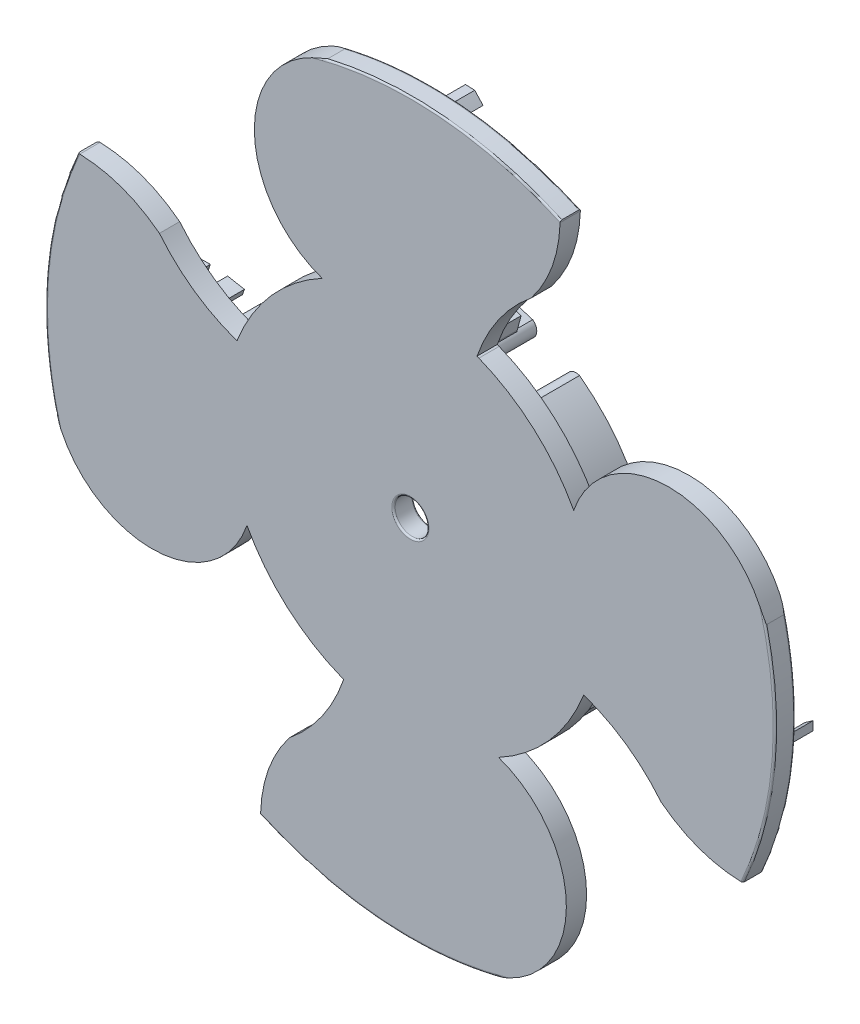
from build123d import *

# Parameters (mm, degrees)
ESQUISSE1_R             = 54
BOSS_EXTRU_1_DEPTH      = 3
ESQUISSE2_R             = 2.5
ENL_V_MAT_EXTRU_1_DEPTH = 77.426435217
CONG_1_R                = 0.25
ENL_V_MAT_EXTRU_3_DEPTH = 6
BOSS_EXTRU_2_DEPTH      = 6
BOSS_EXTRU_3_DEPTH      = 3
ESQUISSE7_R             = 32.5
ESQUISSE7_R_2           = 30
ENL_V_MAT_EXTRU_4_DEPTH = 3
ESQUISSE8_R             = 37.5
ESQUISSE8_R_2           = 35
ENL_V_MAT_EXTRU_5_DEPTH = 3
ESQUISSE9_R             = 42.5
ESQUISSE9_R_2           = 40
ENL_V_MAT_EXTRU_6_DEPTH = 3
ESQUISSE10_R            = 47.5
ESQUISSE10_R_2          = 45
ENL_V_MAT_EXTRU_7_DEPTH = 3
ESQUISSE11_R            = 52.5
ESQUISSE11_R_2          = 50
ENL_V_MAT_EXTRU_8_DEPTH = 3
CONG_2_R                = 0.25
CONG_4_R                = 0.25


with BuildPart() as part:
    # Esquisse1 → Boss.-Extru.1 (new body)
    with BuildSketch(Plane.XY):
        Circle(ESQUISSE1_R)
    extrude(amount=BOSS_EXTRU_1_DEPTH)

    # Esquisse2 → Enlèv. mat.-Extru.1 (cut, through all)
    with BuildSketch(Plane.XY.offset(3)):
        Circle(ESQUISSE2_R)
    extrude(amount=-ENL_V_MAT_EXTRU_1_DEPTH, mode=Mode.SUBTRACT)

    # Congé1
    cong_1_edges = [part.edges().sort_by_distance(p)[0] for p in [
        (-54, 0, 0),
        (-54, 0, 3),
    ]]
    fillet(cong_1_edges, radius=CONG_1_R)

    # Esquisse4 → Enlèv. mat.-Extru.3 (cut)
    with BuildSketch(Plane.XY.offset(3)):
        with BuildLine():
            Line((10.147494885, 25.559310389), (9.869093006, 25.668093097))
            ThreePointArc((9.869093006, 25.668093097), (13.084415188, 31.983211129), (17.916194387, 37.16712107))
            add(Edge.make_bspline(
                [(17.916194387, 37.16712107), (21.972653712, 42.426454658), (22.178832884, 48.960819763)],
                knots=[0, 0, 0, 1, 1, 1], degree=2))
            Line((22.178832884, 48.960819763), (22.293738471, 50.024043225))
            Line((22.293738471, 50.024043225), (35.112139276, 43.739905038))
            Line((35.112139276, 43.739905038), (38.990932512, 44.188049256))
            Line((38.990932512, 44.188049256), (53.026120216, 33.383027581))
            Line((53.026120216, 33.383027581), (55.655170053, 10.62798506))
            Line((55.655170053, 10.62798506), (53.026120216, 10.209337629))
            ThreePointArc((53.026120216, 10.209337629), (39.741245532, 23.034120654), (24.197434096, 13.066529116))
            ThreePointArc((24.197434096, 13.066529116), (18.273229946, 20.550889697), (10.147494885, 25.559310389))
        make_face()
        with BuildLine():
            Line((10.209337629, -53.026120216), (10.62798506, -55.655170053))
            Line((10.62798506, -55.655170053), (33.383027581, -53.026120216))
            Line((33.383027581, -53.026120216), (44.188049256, -38.990932512))
            Line((44.188049256, -38.990932512), (43.739905038, -35.112139276))
            Line((43.739905038, -35.112139276), (50.024043225, -22.293738471))
            Line((50.024043225, -22.293738471), (48.960819763, -22.178832884))
            add(Edge.make_bspline(
                [(37.16712107, -17.916194387), (42.426454658, -21.972653712), (48.960819763, -22.178832884)],
                knots=[0, 0, 0, 1, 1, 1], degree=2))
            ThreePointArc((37.16712107, -17.916194387), (31.983211129, -13.084415188), (25.668093097, -9.869093006))
            Line((25.668093097, -9.869093006), (25.559310389, -10.147494885))
            ThreePointArc((25.559310389, -10.147494885), (20.550889697, -18.273229946), (13.066529116, -24.197434096))
            ThreePointArc((13.066529116, -24.197434096), (23.034120654, -39.741245532), (10.209337629, -53.026120216))
        make_face()
        with BuildLine():
            Line((-53.026120216, -10.209337629), (-55.655170053, -10.62798506))
            Line((-55.655170053, -10.62798506), (-53.026120216, -33.383027581))
            Line((-53.026120216, -33.383027581), (-38.990932512, -44.188049256))
            Line((-38.990932512, -44.188049256), (-35.112139276, -43.739905038))
            Line((-35.112139276, -43.739905038), (-22.293738471, -50.024043225))
            Line((-22.293738471, -50.024043225), (-22.178832884, -48.960819763))
            add(Edge.make_bspline(
                [(-17.916194387, -37.16712107), (-21.972653712, -42.426454658), (-22.178832884, -48.960819763)],
                knots=[0, 0, 0, 1, 1, 1], degree=2))
            ThreePointArc((-17.916194387, -37.16712107), (-13.084415188, -31.983211129), (-9.869093006, -25.668093097))
            Line((-9.869093006, -25.668093097), (-10.147494885, -25.559310389))
            ThreePointArc((-10.147494885, -25.559310389), (-18.273229946, -20.550889697), (-24.197434096, -13.066529116))
            ThreePointArc((-24.197434096, -13.066529116), (-39.741245532, -23.034120654), (-53.026120216, -10.209337629))
        make_face()
        with BuildLine():
            Line((-10.209337629, 53.026120216), (-10.62798506, 55.655170053))
            Line((-10.62798506, 55.655170053), (-33.383027581, 53.026120216))
            Line((-33.383027581, 53.026120216), (-44.188049256, 38.990932512))
            Line((-44.188049256, 38.990932512), (-43.739905038, 35.112139276))
            Line((-43.739905038, 35.112139276), (-50.024043225, 22.293738471))
            Line((-50.024043225, 22.293738471), (-48.960819763, 22.178832884))
            add(Edge.make_bspline(
                [(-37.16712107, 17.916194387), (-42.426454658, 21.972653712), (-48.960819763, 22.178832884)],
                knots=[0, 0, 0, 1, 1, 1], degree=2))
            ThreePointArc((-37.16712107, 17.916194387), (-31.983211129, 13.084415188), (-25.668093097, 9.869093006))
            Line((-25.668093097, 9.869093006), (-25.559310389, 10.147494885))
            ThreePointArc((-25.559310389, 10.147494885), (-20.550889697, 18.273229946), (-13.066529116, 24.197434096))
            ThreePointArc((-13.066529116, 24.197434096), (-23.034120654, 39.741245532), (-10.209337629, 53.026120216))
        make_face()
    extrude(amount=-ENL_V_MAT_EXTRU_3_DEPTH, mode=Mode.SUBTRACT)

    # Esquisse5 → Boss.-Extru.2 (add)
    with BuildSketch(Plane(origin=(0, 0, 0), x_dir=(-1, 0, 0), z_dir=(0, 0, -1))):
        with BuildLine():
            ThreePointArc((-19.578572111, -14.475771568), (-7.02125442, -23.314597031), (8.32873924, -22.880134419))
            ThreePointArc((8.32873924, -22.880134419), (9.663302639, -23.894032104), (9.120552968, -25.479740392))
            ThreePointArc((9.120552968, -25.479740392), (-7.891326565, -25.886842641), (-21.783210866, -16.059059165))
            ThreePointArc((-21.783210866, -16.059059165), (-21.309231997, -14.392486616), (-19.578572111, -14.475771568))
        make_face()
        with BuildLine():
            ThreePointArc((-14.475771568, 19.578572111), (-23.314597031, 7.02125442), (-22.880134419, -8.32873924))
            ThreePointArc((-22.880134419, -8.32873924), (-23.894032104, -9.663302639), (-25.479740392, -9.120552968))
            ThreePointArc((-25.479740392, -9.120552968), (-25.886842641, 7.891326565), (-16.059059165, 21.783210866))
            ThreePointArc((-16.059059165, 21.783210866), (-14.392486616, 21.309231997), (-14.475771568, 19.578572111))
        make_face()
        with BuildLine():
            ThreePointArc((19.578572111, 14.475771568), (7.02125442, 23.314597031), (-8.32873924, 22.880134419))
            ThreePointArc((-8.32873924, 22.880134419), (-9.663302639, 23.894032104), (-9.120552968, 25.479740392))
            ThreePointArc((-9.120552968, 25.479740392), (7.891326565, 25.886842641), (21.783210866, 16.059059165))
            ThreePointArc((21.783210866, 16.059059165), (21.309231997, 14.392486616), (19.578572111, 14.475771568))
        make_face()
        with BuildLine():
            ThreePointArc((14.475771568, -19.578572111), (23.314597031, -7.02125442), (22.880134419, 8.32873924))
            ThreePointArc((22.880134419, 8.32873924), (23.894032104, 9.663302639), (25.479740392, 9.120552968))
            ThreePointArc((25.479740392, 9.120552968), (25.886842641, -7.891326565), (16.059059165, -21.783210866))
            ThreePointArc((16.059059165, -21.783210866), (14.392486616, -21.309231997), (14.475771568, -19.578572111))
        make_face()
    extrude(amount=BOSS_EXTRU_2_DEPTH)

    # Esquisse6 → Boss.-Extru.3 (add)
    with BuildSketch(Plane(origin=(0, 0, 0), x_dir=(-1, 0, 0), z_dir=(0, 0, -1))):
        with BuildLine():
            Line((-9.434750277, 25.918438314), (-8.933382957, 26.094115156))
            add(Edge.make_bspline(
                [(-8.933382957, 26.094115156), (-9.18298748, 27.239687374), (-9.844748625, 29.572735583), (-10.993440474, 33.722609322), (-10.495852674, 38.496338993), (-9.170485204, 44.608093795), (-5.51438874, 49.24341749), (-2.938664833, 52.517046529), (-2.165830076, 53.671866873)],
                knots=[0, 0, 0, 0, 0.116455667, 0.242283052, 0.424246859, 0.586993622, 0.857841247, 0.998561387, 0.998561387, 0.998561387, 0.998561387], degree=3))
            Line((-2.165830076, 53.671866873), (-3.532628362, 53.612438178))
            add(Edge.make_bspline(
                [(-3.532628362, 53.612438178), (-4.922592815, 52.186117727), (-7.721146052, 48.872670752), (-10.975949737, 42.779086871), (-12.150899527, 35.72661062), (-10.958422905, 30.074041509), (-10.101878591, 26.999079616), (-9.826252927, 25.964721008)],
                knots=[0.001063965, 0.001063965, 0.001063965, 0.001063965, 0.200578419, 0.429163585, 0.682970587, 0.892585785, 1, 1, 1, 1], degree=3))
            Line((-9.826252927, 25.964721008), (-9.772248127, 25.762053632))
            Line((-9.772248127, 25.762053632), (-9.434750277, 25.918438314))
        make_face()
        with BuildLine():
            Line((53.671866873, 2.165830076), (53.612438178, 3.532628362))
            add(Edge.make_bspline(
                [(53.612438178, 3.532628362), (52.186117727, 4.922592815), (48.872670752, 7.721146052), (42.779086871, 10.975949737), (35.72661062, 12.150899527), (30.074041509, 10.958422905), (26.999079616, 10.101878591), (25.964721008, 9.826252927)],
                knots=[0.001063965, 0.001063965, 0.001063965, 0.001063965, 0.200578419, 0.429163585, 0.682970587, 0.892585785, 1, 1, 1, 1], degree=3))
            Line((25.964721008, 9.826252927), (25.762053632, 9.772248127))
            Line((25.762053632, 9.772248127), (25.918438314, 9.434750277))
            Line((25.918438314, 9.434750277), (26.094115156, 8.933382957))
            add(Edge.make_bspline(
                [(26.094115156, 8.933382957), (27.239687374, 9.18298748), (29.572735583, 9.844748625), (33.722609322, 10.993440474), (38.496338993, 10.495852674), (44.608093795, 9.170485204), (49.24341749, 5.51438874), (52.517046529, 2.938664833), (53.671866873, 2.165830076)],
                knots=[0, 0, 0, 0, 0.116455667, 0.242283052, 0.424246859, 0.586993622, 0.857841247, 0.998561387, 0.998561387, 0.998561387, 0.998561387], degree=3))
        make_face()
        with BuildLine():
            Line((2.165830076, -53.671866873), (3.532628362, -53.612438178))
            add(Edge.make_bspline(
                [(3.532628362, -53.612438178), (4.922592815, -52.186117727), (7.721146052, -48.872670752), (10.975949737, -42.779086871), (12.150899527, -35.72661062), (10.958422905, -30.074041509), (10.101878591, -26.999079616), (9.826252927, -25.964721008)],
                knots=[0.001063965, 0.001063965, 0.001063965, 0.001063965, 0.200578419, 0.429163585, 0.682970587, 0.892585785, 1, 1, 1, 1], degree=3))
            Line((9.826252927, -25.964721008), (9.772248127, -25.762053632))
            Line((9.772248127, -25.762053632), (9.434750277, -25.918438314))
            Line((9.434750277, -25.918438314), (8.933382957, -26.094115156))
            add(Edge.make_bspline(
                [(8.933382957, -26.094115156), (9.18298748, -27.239687374), (9.844748625, -29.572735583), (10.993440474, -33.722609322), (10.495852674, -38.496338993), (9.170485204, -44.608093795), (5.51438874, -49.24341749), (2.938664833, -52.517046529), (2.165830076, -53.671866873)],
                knots=[0, 0, 0, 0, 0.116455667, 0.242283052, 0.424246859, 0.586993622, 0.857841247, 0.998561387, 0.998561387, 0.998561387, 0.998561387], degree=3))
        make_face()
        with BuildLine():
            Line((-53.671866873, -2.165830076), (-53.612438178, -3.532628362))
            add(Edge.make_bspline(
                [(-53.612438178, -3.532628362), (-52.186117727, -4.922592815), (-48.872670752, -7.721146052), (-42.779086871, -10.975949737), (-35.72661062, -12.150899527), (-30.074041509, -10.958422905), (-26.999079616, -10.101878591), (-25.964721008, -9.826252927)],
                knots=[0.001063965, 0.001063965, 0.001063965, 0.001063965, 0.200578419, 0.429163585, 0.682970587, 0.892585785, 1, 1, 1, 1], degree=3))
            Line((-25.964721008, -9.826252927), (-25.762053632, -9.772248127))
            Line((-25.762053632, -9.772248127), (-25.918438314, -9.434750277))
            Line((-25.918438314, -9.434750277), (-26.094115156, -8.933382957))
            add(Edge.make_bspline(
                [(-26.094115156, -8.933382957), (-27.239687374, -9.18298748), (-29.572735583, -9.844748625), (-33.722609322, -10.993440474), (-38.496338993, -10.495852674), (-44.608093795, -9.170485204), (-49.24341749, -5.51438874), (-52.517046529, -2.938664833), (-53.671866873, -2.165830076)],
                knots=[0, 0, 0, 0, 0.116455667, 0.242283052, 0.424246859, 0.586993622, 0.857841247, 0.998561387, 0.998561387, 0.998561387, 0.998561387], degree=3))
        make_face()
    extrude(amount=BOSS_EXTRU_3_DEPTH)

    # Esquisse7 → Enlèv. mat.-Extru.4 (cut)
    with BuildSketch(Plane(origin=(0, 0, 0), x_dir=(-1, 0, 0), z_dir=(0, 0, -1))):
        Circle(ESQUISSE7_R)
        Circle(ESQUISSE7_R_2, mode=Mode.SUBTRACT)
    extrude(amount=ENL_V_MAT_EXTRU_4_DEPTH, mode=Mode.SUBTRACT)

    # Esquisse8 → Enlèv. mat.-Extru.5 (cut)
    with BuildSketch(Plane(origin=(0, 0, 0), x_dir=(-1, 0, 0), z_dir=(0, 0, -1))):
        Circle(ESQUISSE8_R)
        Circle(ESQUISSE8_R_2, mode=Mode.SUBTRACT)
    extrude(amount=ENL_V_MAT_EXTRU_5_DEPTH, mode=Mode.SUBTRACT)

    # Esquisse9 → Enlèv. mat.-Extru.6 (cut)
    with BuildSketch(Plane(origin=(0, 0, 0), x_dir=(-1, 0, 0), z_dir=(0, 0, -1))):
        Circle(ESQUISSE9_R)
        Circle(ESQUISSE9_R_2, mode=Mode.SUBTRACT)
    extrude(amount=ENL_V_MAT_EXTRU_6_DEPTH, mode=Mode.SUBTRACT)

    # Esquisse10 → Enlèv. mat.-Extru.7 (cut)
    with BuildSketch(Plane(origin=(0, 0, 0), x_dir=(-1, 0, 0), z_dir=(0, 0, -1))):
        Circle(ESQUISSE10_R)
        Circle(ESQUISSE10_R_2, mode=Mode.SUBTRACT)
    extrude(amount=ENL_V_MAT_EXTRU_7_DEPTH, mode=Mode.SUBTRACT)

    # Esquisse11 → Enlèv. mat.-Extru.8 (cut)
    with BuildSketch(Plane(origin=(0, 0, 0), x_dir=(-1, 0, 0), z_dir=(0, 0, -1))):
        Circle(ESQUISSE11_R)
        Circle(ESQUISSE11_R_2, mode=Mode.SUBTRACT)
    extrude(amount=ENL_V_MAT_EXTRU_8_DEPTH, mode=Mode.SUBTRACT)

    # Congé2
    cong_2_edges = [part.edges().sort_by_distance(p)[0] for p in [
        (-2.5, 0, 3),
    ]]
    fillet(cong_2_edges, radius=CONG_2_R)

    # Congé4
    cong_4_edges = [part.edges().sort_by_distance(p)[0] for p in [
        (-2.5, 0, 0),
    ]]
    fillet(cong_4_edges, radius=CONG_4_R)


solid = part.part
